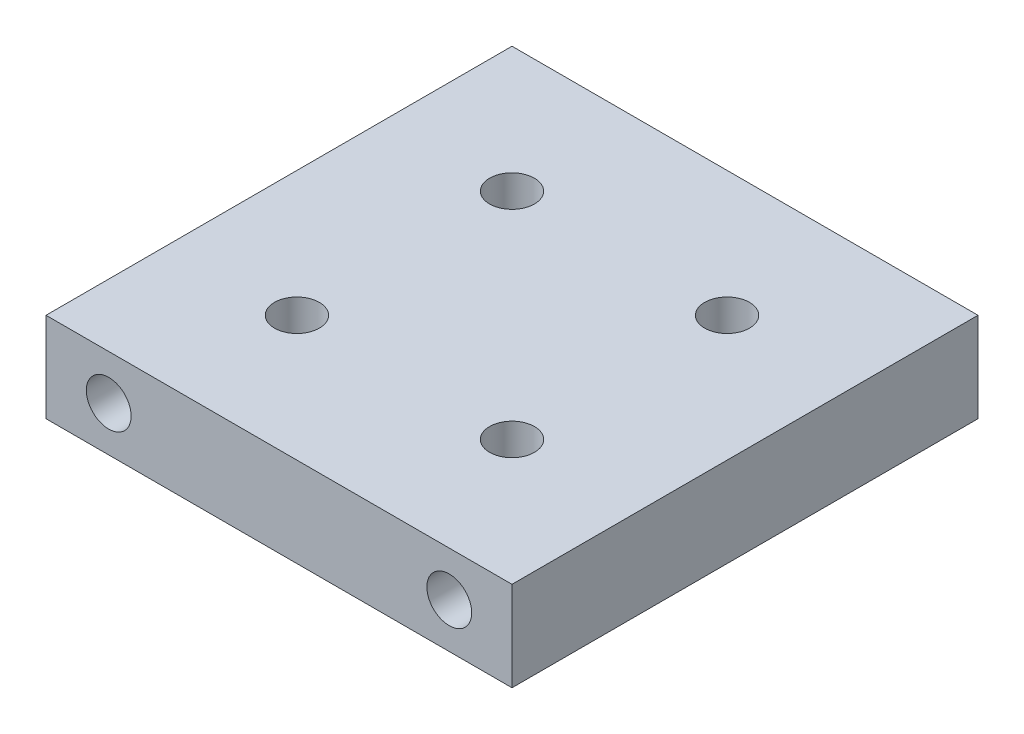
from build123d import *

# Parameters (mm, degrees)
SKETCH1_W           = 26
SKETCH1_H           = 26
SKETCH1_R           = 1.25
BOSS_EXTRUDE1_DEPTH = 5
SKETCH2_R           = 1.25
CUT_EXTRUDE1_DEPTH  = 10
LPATTERN1_COUNT     = 2
LPATTERN1_PITCH     = 16


with BuildPart() as part:
    # Sketch1 → Boss-Extrude1 (new body)
    with BuildSketch(Plane(origin=(0, 0, 0), x_dir=(1, 0, 0), z_dir=(0, 1, 0))):
        Rectangle(SKETCH1_W, SKETCH1_H)
        with Locations(Location((-6, -6, 0), (0, 0, 270))):
            Circle(SKETCH1_R, mode=Mode.SUBTRACT)
        with Locations(Location((6, -6, 0), (0, 0, 270))):
            Circle(SKETCH1_R, mode=Mode.SUBTRACT)
        with Locations(Location((6, 6, 0), (0, 0, 270))):
            Circle(SKETCH1_R, mode=Mode.SUBTRACT)
        with Locations(Location((-6, 6, 0), (0, 0, 270))):
            Circle(SKETCH1_R, mode=Mode.SUBTRACT)
    extrude(amount=BOSS_EXTRUDE1_DEPTH)

    # Sketch2 → Cut-Extrude1 (cut)
    with BuildSketch(Plane.XY.offset(13)):
        with Locations((-9.5, 2.5)):
            Circle(SKETCH2_R)
        with Locations(Location((9.5, 2.5, 0), (0, 0, 180))):
            Circle(SKETCH2_R)
    cut_extrude1 = extrude(amount=-CUT_EXTRUDE1_DEPTH, mode=Mode.SUBTRACT)

    # LPattern1: Cut-Extrude1 ×2
    with Locations(*[(0, 0, -i * LPATTERN1_PITCH) for i in range(1, LPATTERN1_COUNT)]):
        add(cut_extrude1, mode=Mode.SUBTRACT)


solid = part.part
